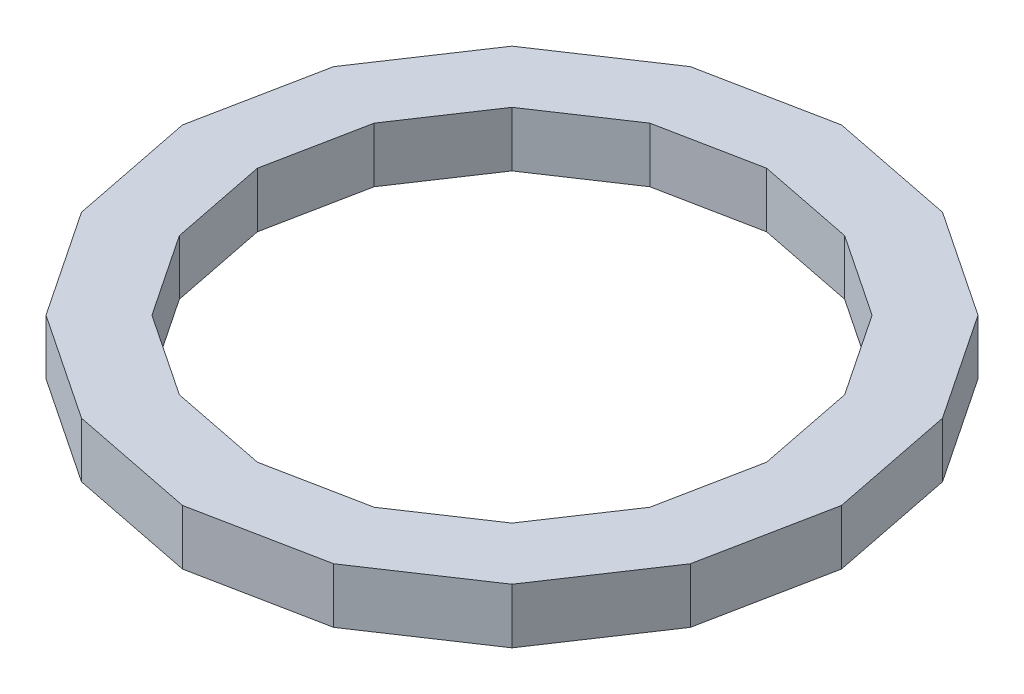
from build123d import *

# Parameters (mm, degrees)
BOSS_EXTRUDE1_DEPTH = 19.05


with BuildPart() as part:
    # Sketch1 → Boss-Extrude1 (new body)
    with BuildSketch(Plane(origin=(0, 0, 0), x_dir=(1, 0, 0), z_dir=(0, 1, 0))):
        Polygon((113.921591652, 0), (105.249826838, 43.595905714), (80.554729981, 80.554729981), (43.595905714, 105.249826838), (0, 113.921591652), (-43.595905714, 105.249826838), (-80.554729981, 80.554729981), (-105.249826838, 43.595905714), (-113.921591652, 0), (-105.249826838, -43.595905714), (-80.554729981, -80.554729981), (-43.595905714, -105.249826838), (0, -113.921591652), (43.595905714, -105.249826838), (80.554729981, -80.554729981), (105.249826838, -43.595905714), align=None)
        Polygon((88.023976234, 0), (81.323550012, 33.685317356), (62.242350502, 62.242350502), (33.685317356, 81.323550013), (0, 88.023976234), (-33.685317356, 81.323550012), (-62.242350502, 62.242350502), (-81.323550013, 33.685317356), (-88.023976234, 0), (-81.323550012, -33.685317356), (-62.242350502, -62.242350502), (-33.685317356, -81.323550013), (0, -88.023976234), (33.685317356, -81.323550012), (62.242350502, -62.242350502), (81.323550013, -33.685317356), align=None, mode=Mode.SUBTRACT)
    extrude(amount=BOSS_EXTRUDE1_DEPTH)


solid = part.part
